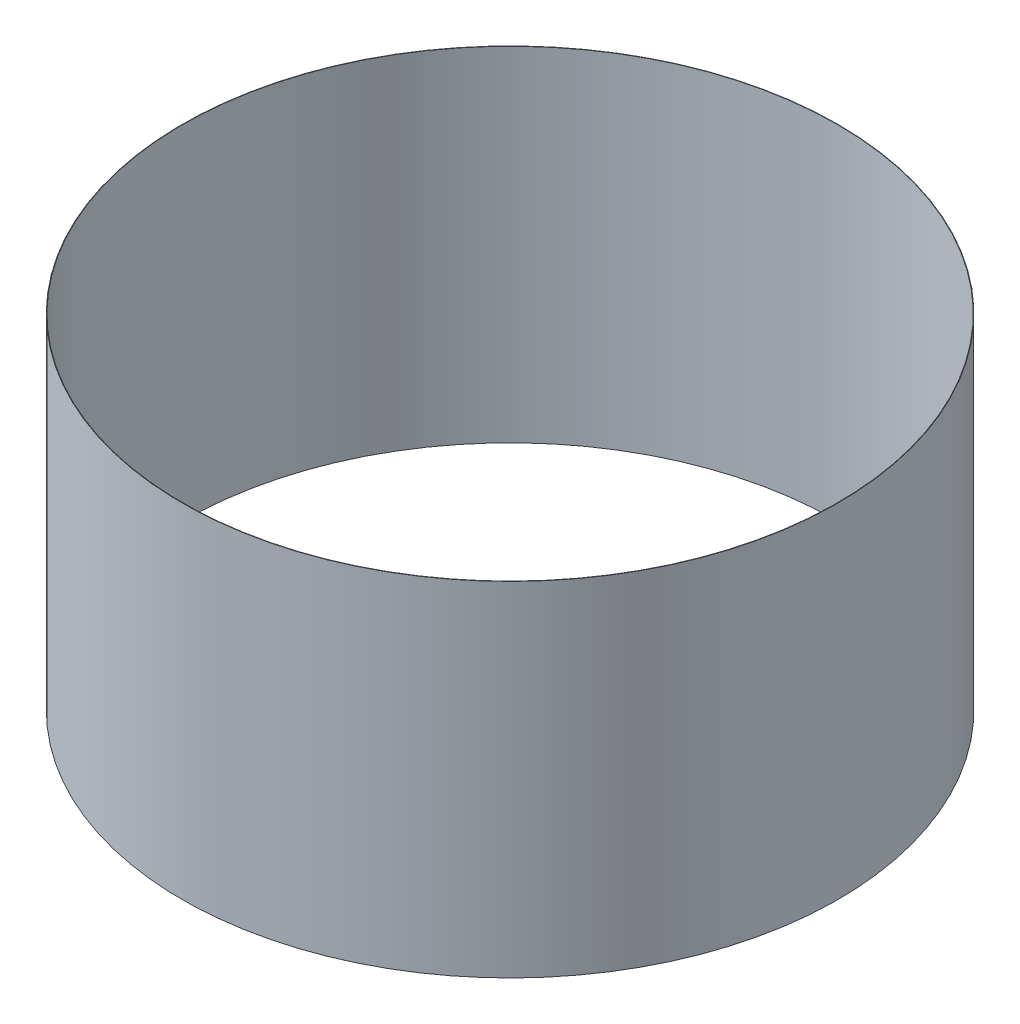
from build123d import *

# Parameters (mm, degrees)
SKETCH1_R           = 195.75
SKETCH1_R_2         = 195.5
EXTRUDE_THIN1_DEPTH = 205


with BuildPart() as part:
    # Sketch1 → Extrude-Thin1 (new body)
    with BuildSketch(Plane(origin=(0, 0, 0), x_dir=(1, 0, 0), z_dir=(0, 1, 0))):
        Circle(SKETCH1_R)
        Circle(SKETCH1_R_2, mode=Mode.SUBTRACT)
    extrude(amount=EXTRUDE_THIN1_DEPTH)


solid = part.part
